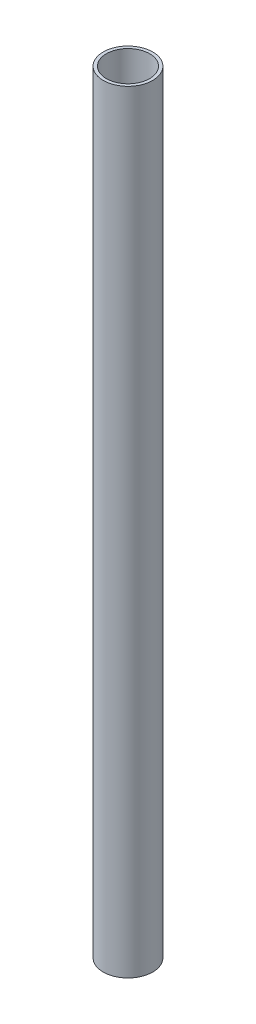
from build123d import *

# Parameters (mm, degrees)
SKETCH_1_R      = 8
SKETCH_1_R_2    = 7
EXTRUDE_1_DEPTH = 250


with BuildPart() as part:
    # 草图1 → 凸台-拉伸1 (new body)
    with BuildSketch(Plane(origin=(0, 0, 0), x_dir=(1, 0, 0), z_dir=(0, 1, 0))):
        with Locations(Location((0, 0, 0), (0, 0, 270))):
            Circle(SKETCH_1_R)
        with Locations(Location((0, 0, 0), (0, 0, 270))):
            Circle(SKETCH_1_R_2, mode=Mode.SUBTRACT)
    extrude(amount=EXTRUDE_1_DEPTH)


solid = part.part
